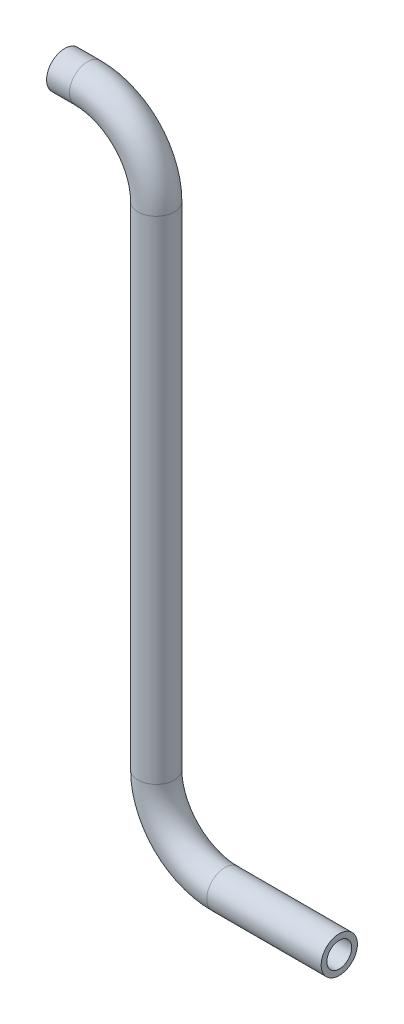
from build123d import *

# Parameters (mm, degrees)
SWEEP_SOTTILE1_PROFILE_R   = 1.585
SWEEP_SOTTILE1_PROFILE_R_2 = 1.085


with BuildPart() as part:
    # Sweep-Sottile1: sweep along a path in Schizzo1
    with BuildLine(Plane.XY) as sweep_sottile1_path:
        Line((-8, 55), (-6, 55))
        ThreePointArc((-6, 55), (-1.757359313, 53.242640687), (0, 49))
        Line((0, 49), (0, 6))
        ThreePointArc((0, 6), (1.757359313, 1.757359313), (6, 0))
        Line((6, 0), (16, 0))
    # Sweep-Sottile1 profile (on start of the path) → Sweep-Sottile1 (sweep)
    with BuildSketch(Plane(origin=(-8, 55, 0), x_dir=(0, 0, 1), z_dir=(1, 0, 0))):
        Circle(SWEEP_SOTTILE1_PROFILE_R)
        Circle(SWEEP_SOTTILE1_PROFILE_R_2, mode=Mode.SUBTRACT)
    sweep(path=sweep_sottile1_path.line)


solid = part.part
